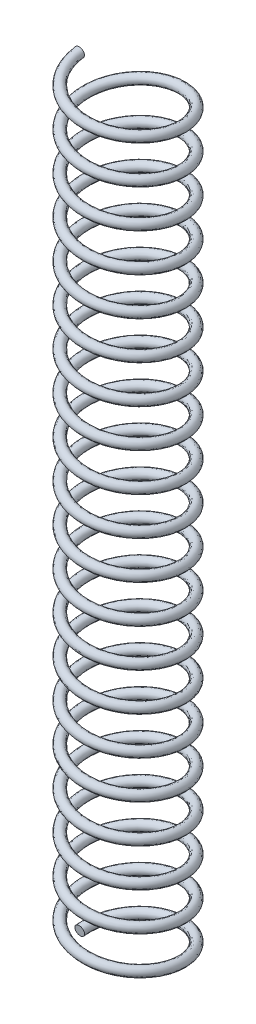
from build123d import *

# Parameters (mm, degrees)
SWEEP1_PITCH       = 2
SWEEP1_HEIGHT      = 40
SWEEP1_RADIUS      = 2.54
SWEEP1_START_ANGLE = -90
SWEEP1_PROFILE_R   = 0.254


with BuildPart() as part:
    # Sweep1: sweep along a helix
    with BuildLine() as sweep1_path:
        add(Helix(SWEEP1_PITCH, SWEEP1_HEIGHT, SWEEP1_RADIUS, center=(0, 0, 0), direction=(0, 1, 0), lefthand=True, mode=Mode.PRIVATE).rotate(Axis((0, 0, 0), (0, 1, 0)), SWEEP1_START_ANGLE))
    # Sweep1 profile (on start of the path) → Sweep1 (sweep)
    with BuildSketch(Plane(origin=(-2.54, 0, 0), x_dir=(0, -0.9922388889641419, -0.12434623929659272), z_dir=(-8.878991493978081e-14, 0.12434623929659272, -0.9922388889641419))):
        Circle(SWEEP1_PROFILE_R)
    sweep(path=sweep1_path.line, is_frenet=True)


solid = part.part
